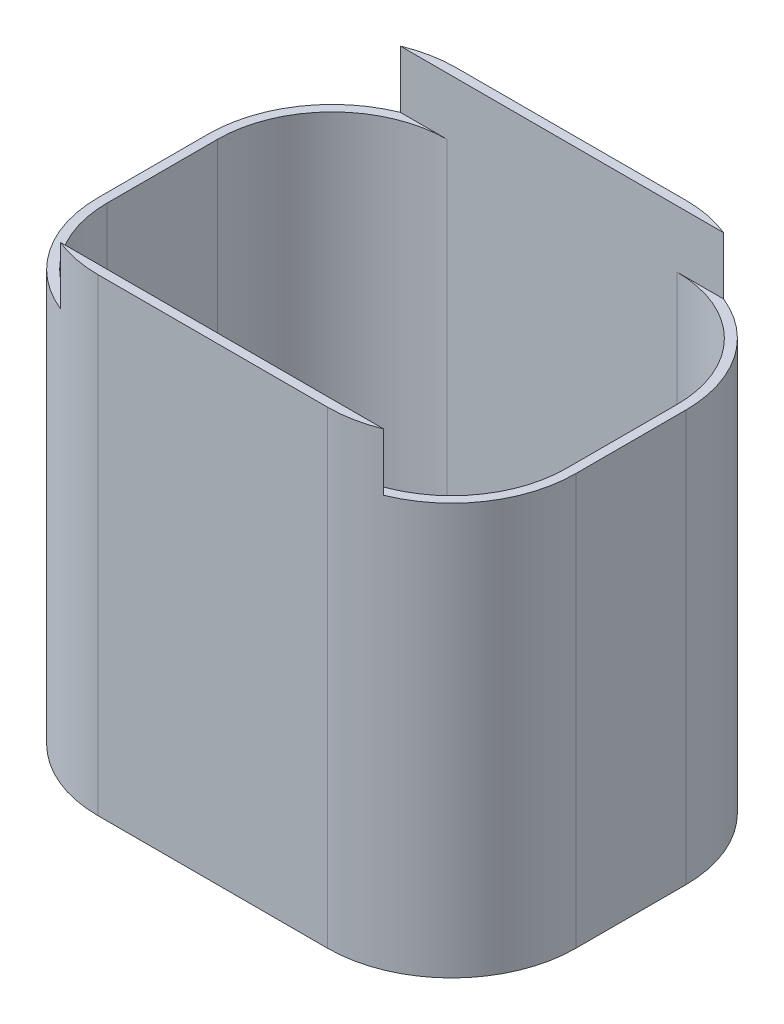
from build123d import *

# Parameters (mm, degrees)
EXTRUDE_1_DEPTH     = 40.8
SKETCH_4_W          = 41.6
SKETCH_4_H          = 29.6
CUT_EXTRUDE_1_DEPTH = 5
EXTRUDE_2_DEPTH     = 0.8
CUT_EXTRUDE_2_DEPTH = 49.380161223


with BuildPart() as part:
    # 草圖1 → 填料-伸長1 (new body)
    with BuildSketch(Plane(origin=(0, 0, 0), x_dir=(1, 0, 0), z_dir=(0, 1, 0))):
        with BuildLine():
            Line((-10, -15.6), (10, -15.6))
            ThreePointArc((10, -15.6), (17.636753237, -12.436753237), (20.8, -4.8))
            Line((20.8, -4.8), (20.8, 4.8))
            ThreePointArc((20.8, 4.8), (17.636753237, 12.436753237), (10, 15.6))
            Line((10, 15.6), (-10, 15.6))
            ThreePointArc((-10, 15.6), (-17.636753237, 12.436753237), (-20.8, 4.8))
            Line((-20.8, 4.8), (-20.8, -4.8))
            ThreePointArc((-20.8, -4.8), (-17.636753237, -12.436753237), (-10, -15.6))
        make_face()
        with BuildLine():
            Line((-10, -14.8), (10, -14.8))
            ThreePointArc((10, -14.8), (17.071067812, -11.871067812), (20, -4.8))
            Line((20, -4.8), (20, 4.8))
            ThreePointArc((20, 4.8), (17.071067812, 11.871067812), (10, 14.8))
            Line((10, 14.8), (-10, 14.8))
            ThreePointArc((-10, 14.8), (-17.071067812, 11.871067812), (-20, 4.8))
            Line((-20, 4.8), (-20, -4.8))
            ThreePointArc((-20, -4.8), (-17.071067812, -11.871067812), (-10, -14.8))
        make_face(mode=Mode.SUBTRACT)
    extrude(amount=EXTRUDE_1_DEPTH)

    # 草圖4 → 除料-伸長1 (cut)
    with BuildSketch(Plane(origin=(0, 40.8, 0), x_dir=(1, 0, 0), z_dir=(0, 1, 0))):
        Rectangle(SKETCH_4_W, SKETCH_4_H)
    extrude(amount=-CUT_EXTRUDE_1_DEPTH, mode=Mode.SUBTRACT)

    # 草圖5 → 填料-伸長2 (add)
    with BuildSketch(Plane.XZ):
        with BuildLine():
            Line((20, 4.8), (20, -4.8))
            ThreePointArc((20, -4.8), (17.071067812, -11.871067812), (10, -14.8))
            Line((10, -14.8), (-10, -14.8))
            ThreePointArc((-10, -14.8), (-17.071067812, -11.871067812), (-20, -4.8))
            Line((-20, -4.8), (-20, 4.8))
            ThreePointArc((-20, 4.8), (-17.071067812, 11.871067812), (-10, 14.8))
            Line((-10, 14.8), (10, 14.8))
            ThreePointArc((10, 14.8), (17.071067812, 11.871067812), (20, 4.8))
        make_face()
    extrude(amount=-EXTRUDE_2_DEPTH)

    # 草圖7 → 除料-伸長2 (cut, through all)
    with BuildSketch(Plane.XZ):
        with BuildLine():
            Line((-7.4, 7.1), (-7.4, -7.1))
            ThreePointArc((-7.4, -7.1), (0, -14.5), (7.4, -7.1))
            Line((7.4, -7.1), (7.4, 7.1))
            ThreePointArc((7.4, 7.1), (0, 14.5), (-7.4, 7.1))
        make_face()
    extrude(amount=-CUT_EXTRUDE_2_DEPTH, mode=Mode.SUBTRACT)


solid = part.part
